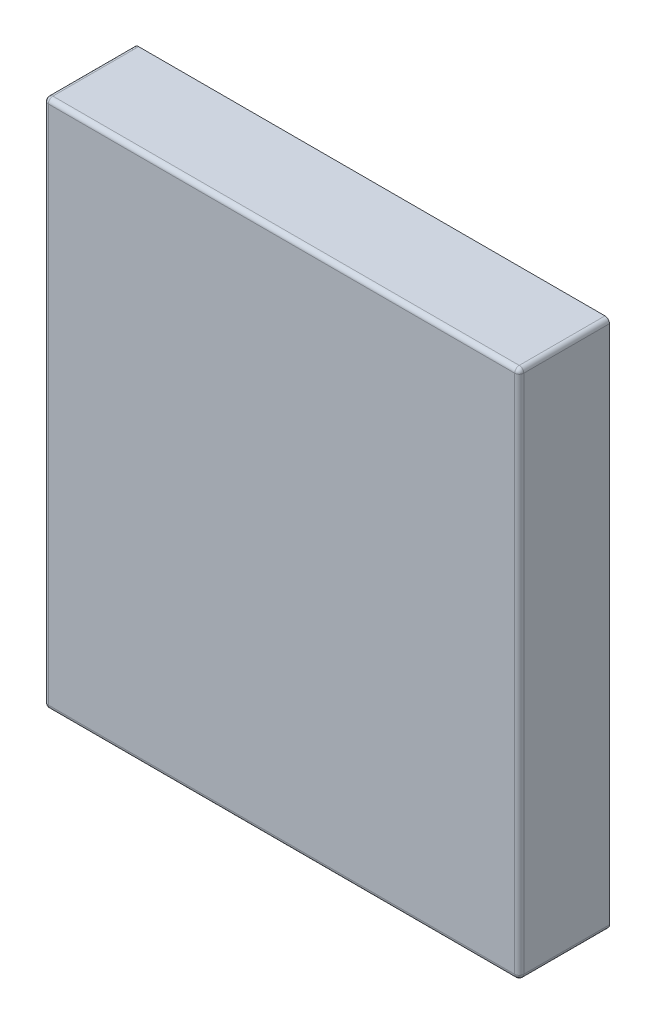
from build123d import *

# Parameters (mm, degrees)
ESBO_O1_W                = 15.8
ESBO_O1_H                = 17.6
RESSALTO_EXTRUS_O1_DEPTH = 1.5
FILETE1_R                = 0.15


with BuildPart() as part:
    # Esboço1 → Ressalto-extrusão1 (new, symmetric)
    with BuildSketch(Plane.XY):
        Rectangle(ESBO_O1_W, ESBO_O1_H)
    extrude(amount=RESSALTO_EXTRUS_O1_DEPTH, both=True)

    # Filete1
    filete1_edges = [part.edges().sort_by_distance(p)[0] for p in [
        (7.9, 0, 1.5),
        (0, 8.8, 1.5),
        (-7.9, 0, 1.5),
        (-7.9, 8.8, 0),
        (7.9, 8.8, 0),
        (7.9, -8.8, 0),
        (-7.9, -8.8, 0),
        (0, -8.8, 1.5),
    ]]
    fillet(filete1_edges, radius=FILETE1_R)


solid = part.part
